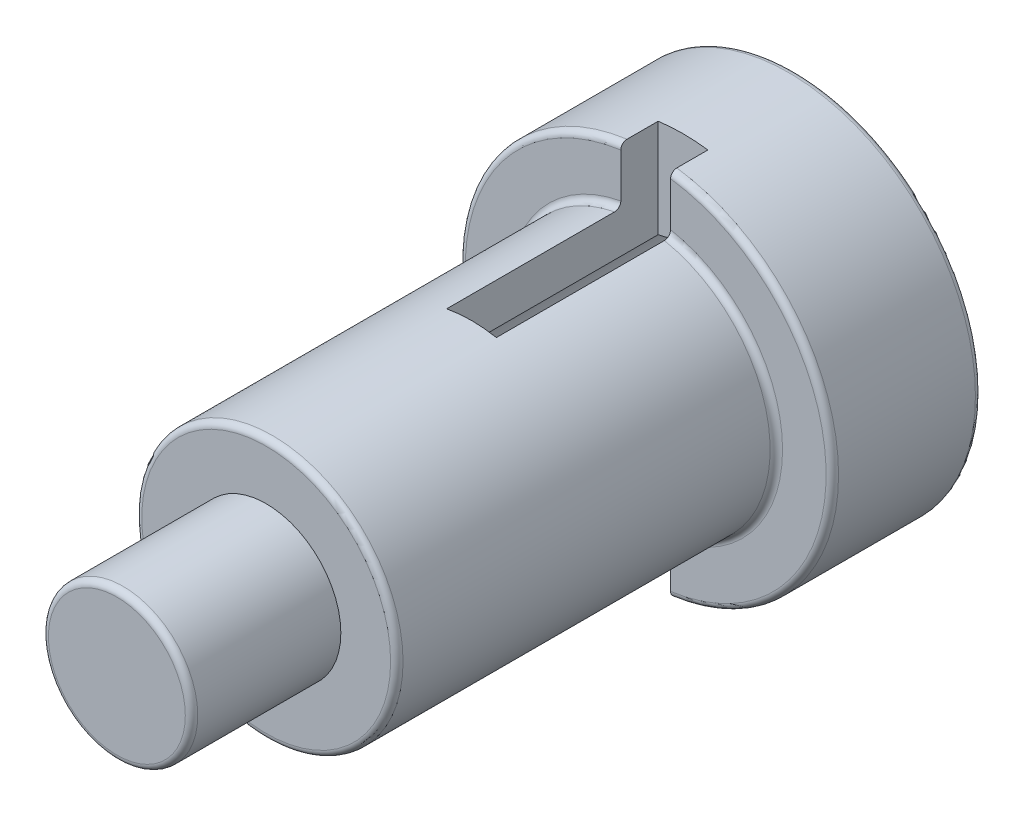
from build123d import *

# Parameters (mm, degrees)
SKETCH1_R               = 30
SKETCH1_R_2             = 21
SKETCH1_R_3             = 12
BOSS_EXTRUDE1_DEPTH     = 24
SKETCH1_3_R             = 21
SKETCH1_3_R_2           = 12
BOSS_EXTRUDE2_DEPTH     = 61
BOSS_EXTRUDE3_START     = 61
SKETCH1_4_R             = 12
BOSS_EXTRUDE3_DEPTH     = 24
SKETCH2_R               = 14.5
CUT_EXTRUDE1_DEPTH      = 70
CUT_EXTRUDE2_DEPTH      = 96
CUT_EXTRUDE2_DEPTH_BACK = 96
SKETCH3_W               = 8
SKETCH3_H               = 34
FILLET1_R               = 1


with BuildPart() as part:
    # Sketch1 → Boss-Extrude1 (new body)
    # profile 1 of 3: a face of its own
    with BuildSketch(Plane.XY):
        Circle(SKETCH1_R)
        Circle(SKETCH1_R_2, mode=Mode.SUBTRACT)
    # profile 2 of 3: a face of its own
    with BuildSketch(Plane.XY):
        Circle(SKETCH1_R_2)
        Circle(SKETCH1_R_3, mode=Mode.SUBTRACT)
    # profile 3 of 3: a face of its own
    with BuildSketch(Plane.XY):
        Circle(SKETCH1_R_3)
    extrude(amount=-BOSS_EXTRUDE1_DEPTH)

    # Sketch1<3> → Boss-Extrude2 (add)
    # profile 1 of 2: a face of its own
    with BuildSketch(Plane.XY):
        with Locations(Location((0, 0, 0), (0, 0, 180))):
            Circle(SKETCH1_3_R)
        Circle(SKETCH1_3_R_2, mode=Mode.SUBTRACT)
    # profile 2 of 2: a face of its own
    with BuildSketch(Plane.XY):
        Circle(SKETCH1_3_R_2)
    extrude(amount=BOSS_EXTRUDE2_DEPTH)

    # Sketch1<4> → Boss-Extrude3 (add)
    with BuildSketch(Plane.XY.offset(BOSS_EXTRUDE3_START)):
        Circle(SKETCH1_4_R)
    extrude(amount=BOSS_EXTRUDE3_DEPTH)

    # Sketch2 → Cut-Extrude1 (cut)
    with BuildSketch(Plane(origin=(0, 0, -24), x_dir=(-1, 0, 0), z_dir=(0, 0, -1))):
        Circle(SKETCH2_R)
    extrude(amount=-CUT_EXTRUDE1_DEPTH, mode=Mode.SUBTRACT)

    # Sketch3 → Cut-Extrude2 (cut, two sides: drawn at the far end of the back side and taken through both)
    with BuildSketch(Plane(origin=(0, 0, 0), x_dir=(1, 0, 0), z_dir=(0, 1, 0)).offset(-CUT_EXTRUDE2_DEPTH_BACK)):
        with Locations((0, -11)):
            Rectangle(SKETCH3_W, SKETCH3_H)
    extrude(amount=CUT_EXTRUDE2_DEPTH + CUT_EXTRUDE2_DEPTH_BACK, mode=Mode.SUBTRACT)

    # Fillet1
    fillet1_edges = [part.edges().sort_by_distance(p)[0] for p in [
        (-12, 0, 85),
        (-16.201851746, -13.360389216, 0),
        (21, 0, 0),
        (-30, 0, 0),
        (22.583179581, 19.748417658, 0),
        (-30, 0, -24),
        (21, 0, 61),
    ]]
    fillet(fillet1_edges, radius=FILLET1_R)


solid = part.part
